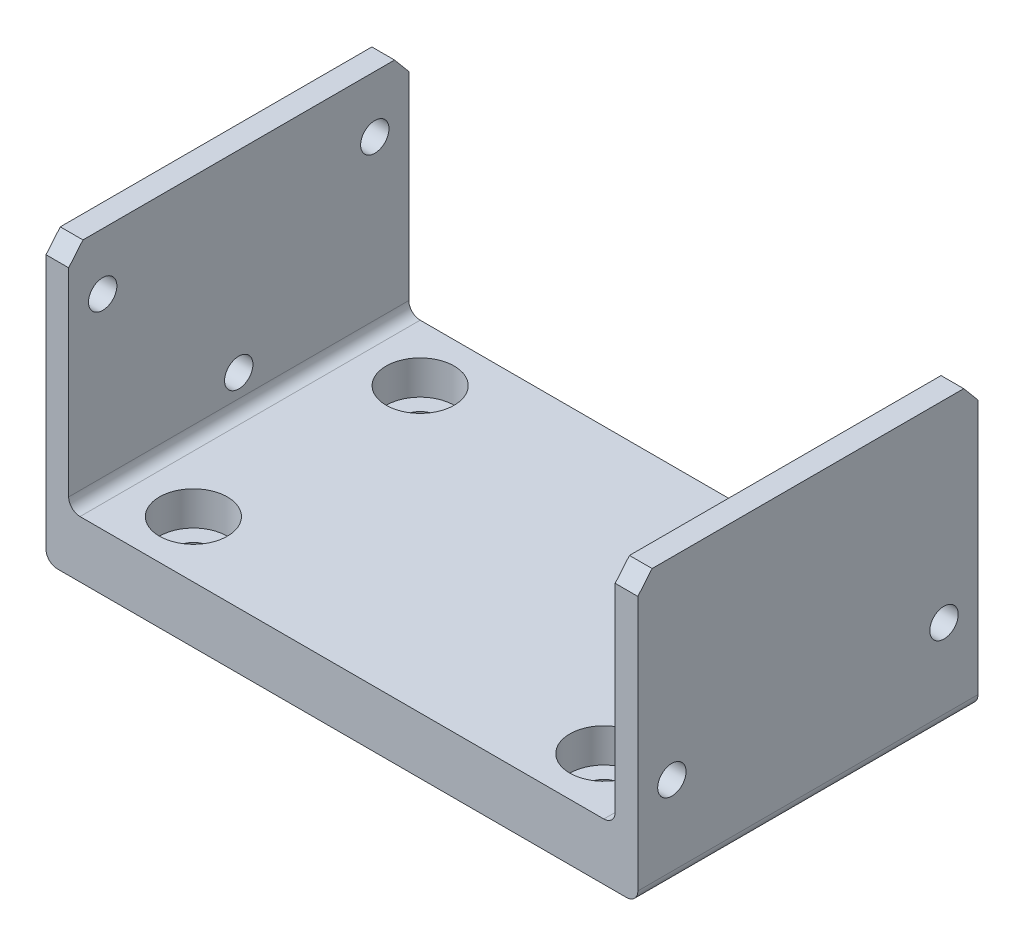
from build123d import *
from OCP.BRepFilletAPI import BRepFilletAPI_MakeChamfer

# Parameters (mm, degrees)
SKETCH1_W           = 52.2
SKETCH1_H           = 30
BOSS_EXTRUDE1_DEPTH = 3
SKETCH2_W           = 2
SKETCH2_H           = 30
BOSS_EXTRUDE2_DEPTH = 20
SKETCH3_W           = 2
SKETCH3_H           = 30
BOSS_EXTRUDE3_DEPTH = 20
SKETCH4_R           = 1.252611376
SKETCH4_R_2         = 1.250208487
CUT_EXTRUDE2_DEPTH  = 5
SKETCH5_R           = 1.25
SKETCH5_R_2         = 1.249999994
CUT_EXTRUDE4_DEPTH  = 5
SKETCH6_R           = 3
CUT_EXTRUDE5_DEPTH  = 3
SKETCH7_W           = 52.2
SKETCH7_H           = 30
BOSS_EXTRUDE4_DEPTH = 2
SKETCH8_R           = 1.45
CUT_EXTRUDE6_DEPTH  = 2
FILLET1_R           = 1
CHAMFER2_SIZE       = 1.5
CHAMFER2_SIZE2      = 1.258649447


with BuildPart() as part:
    # Sketch1 → Boss-Extrude1 (new body)
    with BuildSketch(Plane(origin=(0, 0, 0), x_dir=(1, 0, 0), z_dir=(0, 1, 0))):
        Rectangle(SKETCH1_W, SKETCH1_H)
    extrude(amount=BOSS_EXTRUDE1_DEPTH)

    # Sketch2 → Boss-Extrude2 (add)
    with BuildSketch(Plane(origin=(0, 3, 0), x_dir=(1, 0, 0), z_dir=(0, 1, 0))):
        with Locations((-25.1, 0)):
            Rectangle(SKETCH2_W, SKETCH2_H)
    extrude(amount=BOSS_EXTRUDE2_DEPTH)

    # Sketch3 → Boss-Extrude3 (add)
    with BuildSketch(Plane(origin=(0, 3, 0), x_dir=(1, 0, 0), z_dir=(0, 1, 0))):
        with Locations((25.1, 0)):
            Rectangle(SKETCH3_W, SKETCH3_H)
    extrude(amount=BOSS_EXTRUDE3_DEPTH)

    # Sketch4 → Cut-Extrude2 (cut)
    with BuildSketch(Plane(origin=(26.1, 0, 0), x_dir=(0, 0, -1), z_dir=(1, 0, 0))):
        with Locations((12, 6)):
            Circle(SKETCH4_R)
        with Locations((-12, 6)):
            Circle(SKETCH4_R_2)
    extrude(amount=-CUT_EXTRUDE2_DEPTH, mode=Mode.SUBTRACT)

    # Sketch5 → Cut-Extrude4 (cut)
    with BuildSketch(Plane(origin=(-24.1, 0, 0), x_dir=(0, 0, -1), z_dir=(1, 0, 0))):
        with Locations((-12.00000002, 18)):
            Circle(SKETCH5_R)
        with Locations((12.00000002, 18)):
            Circle(SKETCH5_R)
        with Locations((0, 6)):
            Circle(SKETCH5_R_2)
    extrude(amount=-CUT_EXTRUDE4_DEPTH, mode=Mode.SUBTRACT)

    # Sketch6 → Cut-Extrude5 (cut)
    with BuildSketch(Plane(origin=(0, 3, 0), x_dir=(1, 0, 0), z_dir=(0, 1, 0))):
        with Locations(Location((-18.1, 10, 0), (0, 0, 270))):
            Circle(SKETCH6_R)
        with Locations(Location((-18.1, -10, 0), (0, 0, 270))):
            Circle(SKETCH6_R)
        with Locations(Location((18.1, 10, 0), (0, 0, 270))):
            Circle(SKETCH6_R)
        with Locations(Location((18.1, -10, 0), (0, 0, 270))):
            Circle(SKETCH6_R)
    extrude(amount=-CUT_EXTRUDE5_DEPTH, mode=Mode.SUBTRACT)

    # Sketch7 → Boss-Extrude4 (add)
    with BuildSketch(Plane.XZ):
        Rectangle(SKETCH7_W, SKETCH7_H)
    extrude(amount=BOSS_EXTRUDE4_DEPTH)

    # Sketch8 → Cut-Extrude6 (cut)
    with BuildSketch(Plane(origin=(0, 0, 0), x_dir=(1, 0, 0), z_dir=(0, 1, 0))):
        with Locations(Location((-18.1, 10, 0), (0, 0, 270))):
            Circle(SKETCH8_R)
        with Locations(Location((18.1, 10, 0), (0, 0, 270))):
            Circle(SKETCH8_R)
        with Locations(Location((18.1, -10, 0), (0, 0, 270))):
            Circle(SKETCH8_R)
        with Locations(Location((-18.1, -10, 0), (0, 0, 270))):
            Circle(SKETCH8_R)
    extrude(amount=-CUT_EXTRUDE6_DEPTH, mode=Mode.SUBTRACT)

    # Fillet1
    fillet1_edges = [part.edges().sort_by_distance(p)[0] for p in [
        (-24.1, 3, 0),
        (24.1, 3, 0),
        (-26.1, -2, 0),
        (26.1, -2, 0),
    ]]
    fillet(fillet1_edges, radius=FILLET1_R)

    # Chamfer2: one chamfer whose edges measure the first distance from different faces: ONE call of the kernel's chamfer builder (chamfer() names one face for all edges)
    chamfer2_edges_1 = [part.edges().sort_by_distance(p)[0] for p in [
        (-25.1, 23, 15),
        (25.1, 23, 15),
    ]]
    chamfer2_side_1 = [part.faces().sort_by_distance(p)[0] for p in [
        (-25.521221977, 11, 15),
    ]]
    chamfer2_edges_2 = [part.edges().sort_by_distance(p)[0] for p in [
        (-25.1, 23, -15),
        (25.1, 23, -15),
    ]]
    chamfer2_side_2 = [part.faces().sort_by_distance(p)[0] for p in [
        (24.678778023, 13.5, -15),
    ]]
    chamfer2 = BRepFilletAPI_MakeChamfer(part.part.solid().wrapped)
    for e in chamfer2_edges_1:
        chamfer2.Add(CHAMFER2_SIZE, CHAMFER2_SIZE2, e.wrapped, chamfer2_side_1[0].wrapped)  # the first distance lies on this face
    for e in chamfer2_edges_2:
        chamfer2.Add(CHAMFER2_SIZE, CHAMFER2_SIZE2, e.wrapped, chamfer2_side_2[0].wrapped)  # the first distance lies on this face
    add(Compound.cast(chamfer2.Shape()), mode=Mode.REPLACE)


solid = part.part
